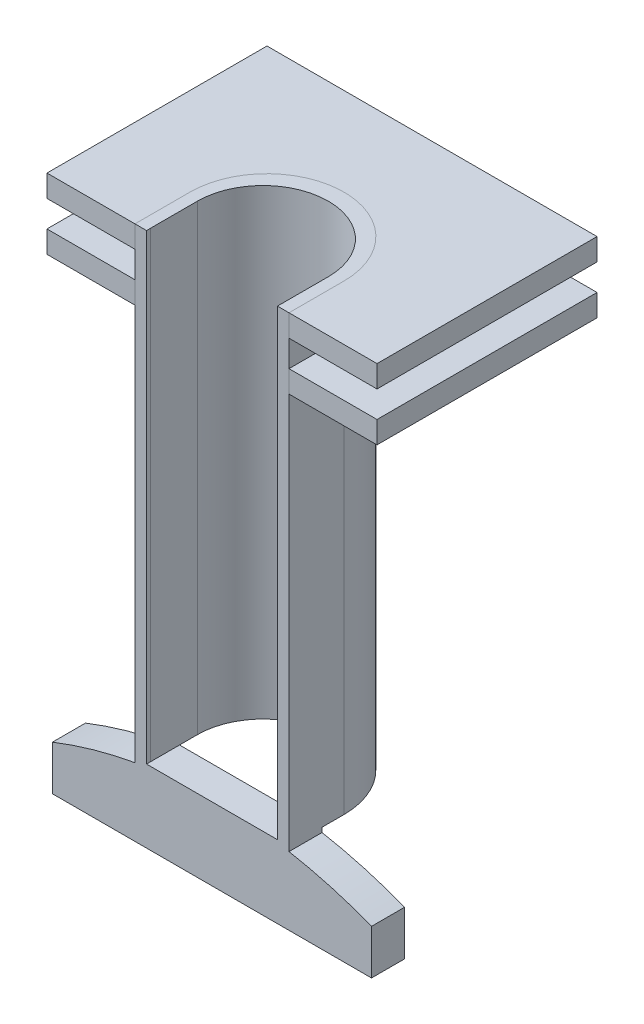
from build123d import *

# Parameters (mm, degrees)
BOSS_EXTRUDE1_DEPTH = 42
BOSS_EXTRUDE2_DEPTH = 2
BOSS_EXTRUDE3_DEPTH = 3
LPATTERN1_COUNT     = 2
LPATTERN1_PITCH     = 4.4


with BuildPart() as part:
    # Sketch1 → Boss-Extrude1 (new body)
    with BuildSketch(Plane(origin=(0, 0, 0), x_dir=(1, 0, 0), z_dir=(0, 1, 0))):
        with BuildLine():
            Line((-7, 5), (-7, 0))
            Line((-7, 0), (-5.938171015, 0))
            ThreePointArc((-5.938171015, 0), (-5.947042018, 0.18740674), (-5.95, 0.375))
            Line((-5.95, 0.375), (-5.95, 4.625))
            ThreePointArc((-5.95, 4.625), (0, 10.575), (5.95, 4.625))
            Line((5.95, 4.625), (5.95, 0.375))
            ThreePointArc((5.95, 0.375), (5.947042018, 0.18740674), (5.938171015, 0))
            Line((5.938171015, 0), (7, 0))
            Line((7, 0), (7, 5))
            ThreePointArc((7, 5), (0, 12), (-7, 5))
        make_face()
    extrude(amount=BOSS_EXTRUDE1_DEPTH)

    # Sketch3 → Boss-Extrude3 (add)
    with BuildSketch(Plane.XY):
        with BuildLine():
            Line((7, 0), (7, -0.415785079))
            ThreePointArc((7, -0.415785079), (10.802746819, -1.296496927), (14.5, -2.548237972))
            Line((14.5, -2.548237972), (14.5, -6.615283027))
            Line((14.5, -6.615283027), (-14.5, -6.615283027))
            Line((-14.5, -6.615283027), (-14.5, -2.548237972))
            ThreePointArc((-14.5, -2.548237972), (-10.802746819, -1.296496927), (-7, -0.415785079))
            Line((-7, -0.415785079), (-7, 0))
            Line((-7, 0), (7, 0))
        make_face()
    extrude(amount=-BOSS_EXTRUDE3_DEPTH)


with BuildPart() as body_2:
    # Sketch2 → Boss-Extrude2 (new body)
    with BuildSketch(Plane(origin=(0, 42, 0), x_dir=(1, 0, 0), z_dir=(0, 1, 0))):
        with BuildLine():
            Line((7, 0), (15, 0))
            Line((15, 0), (15, 20))
            Line((15, 20), (-15, 20))
            Line((-15, 20), (-15, 0))
            Line((-15, 0), (-7, 0))
            Line((-7, 0), (-7, 5))
            ThreePointArc((-7, 5), (0, 12), (7, 5))
            Line((7, 5), (7, 0))
        make_face()
    boss_extrude2 = extrude(amount=-BOSS_EXTRUDE2_DEPTH)


with BuildPart() as lpattern1_1:
    # LPattern1: Boss-Extrude2 ×2
    with Locations(*[(0, -i * LPATTERN1_PITCH, 0) for i in range(1, LPATTERN1_COUNT)]):
        add(boss_extrude2)


solid = Compound([part.part, body_2.part, lpattern1_1.part])
